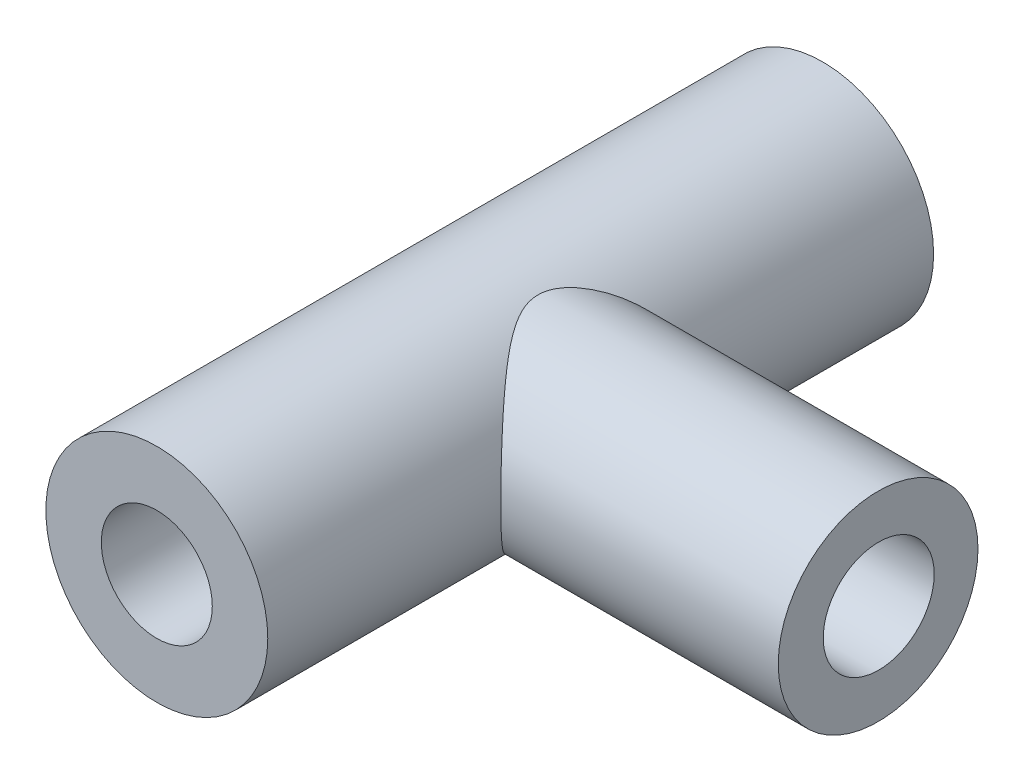
from build123d import *

# Parameters (mm, degrees)
SKETCH1_R                = 10
SKETCH1_R_2              = 5
EXTRUDE_THIN1_DEPTH      = 60
BOSS_EXTRUDE2_REACH      = 77.664
BOSS_EXTRUDE2_END_RADIUS = 10
SKETCH2_R                = 9
CUT_EXTRUDE1_REACH       = 77.664
CUT_EXTRUDE1_END_RADIUS  = 5
SKETCH3_R                = 5


with BuildPart() as part:
    # Sketch1 → Extrude-Thin1 (new body)
    with BuildSketch(Plane.XY):
        Circle(SKETCH1_R)
        Circle(SKETCH1_R_2, mode=Mode.SUBTRACT)
    extrude(amount=EXTRUDE_THIN1_DEPTH)

    # Boss-Extrude2: up to this cylinder (the profile starts outside it)
    boss_extrude2_end = Plane(origin=(0, 0, 30), z_dir=(0, 0, -1)) * Cylinder(BOSS_EXTRUDE2_END_RADIUS, 176.328, mode=Mode.PRIVATE)
    # Sketch2 → Boss-Extrude2 (add, up to the surface)
    with BuildSketch(Plane(origin=(35, 0, 0), x_dir=(0, 0, -1), z_dir=(1, 0, 0)), mode=Mode.PRIVATE) as boss_extrude2_sk1:
        with Locations((-30, 0)):
            Circle(SKETCH2_R)
    boss_extrude2_tool1 = extrude(boss_extrude2_sk1.sketch, amount=-BOSS_EXTRUDE2_REACH, mode=Mode.PRIVATE) - boss_extrude2_end
    add(boss_extrude2_tool1.solids().sort_by_distance((35, 0, 30))[0])

    # Cut-Extrude1: up to this cylinder (the profile starts outside it)
    cut_extrude1_end = Plane(origin=(0, 0, 29.948253), z_dir=(0, 0, -1)) * Cylinder(CUT_EXTRUDE1_END_RADIUS, 166.328, mode=Mode.PRIVATE)
    # Sketch3 → Cut-Extrude1 (cut, up to the surface)
    with BuildSketch(Plane(origin=(35, 0, 0), x_dir=(0, 0, -1), z_dir=(1, 0, 0)), mode=Mode.PRIVATE) as cut_extrude1_sk1:
        with Locations((-29.948253287, 0)):
            Circle(SKETCH3_R)
    cut_extrude1_tool1 = extrude(cut_extrude1_sk1.sketch, amount=-CUT_EXTRUDE1_REACH, mode=Mode.PRIVATE) - cut_extrude1_end
    add(cut_extrude1_tool1.solids().sort_by_distance((35, 0, 29.948253))[0], mode=Mode.SUBTRACT)


solid = part.part
